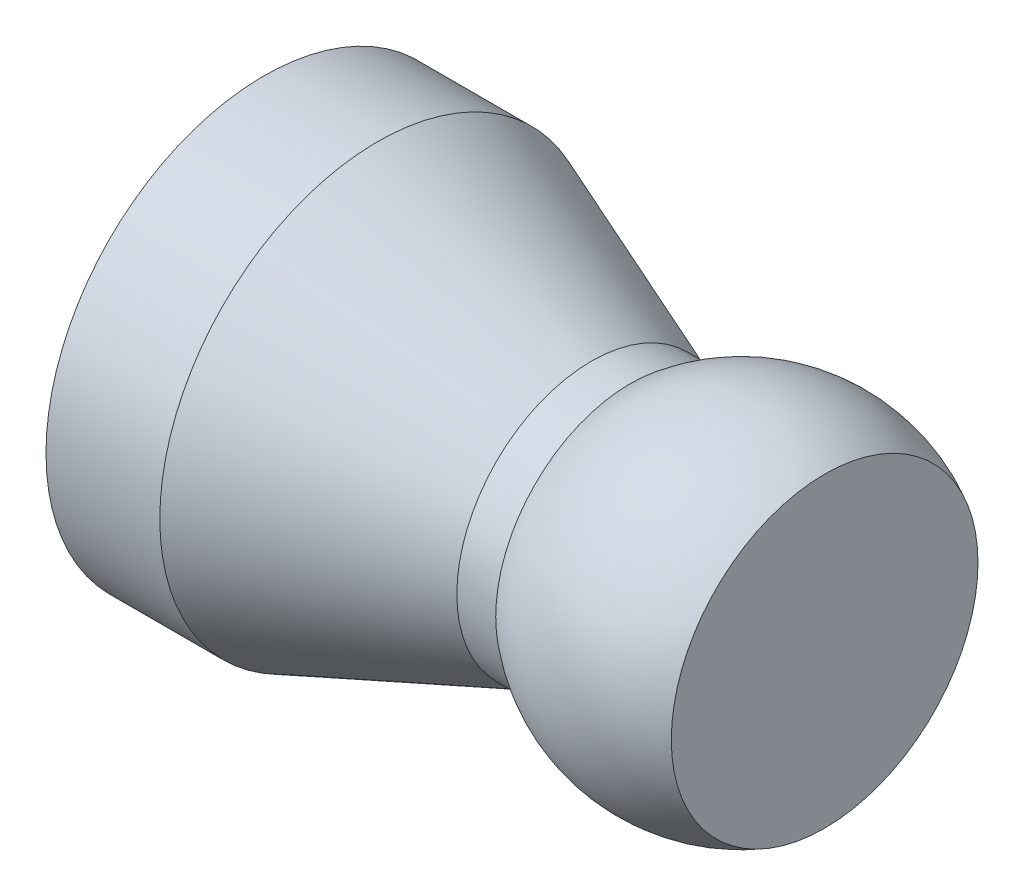
from build123d import *


with BuildPart() as part:
    # 草图1 → 旋转1 (revolve)
    with BuildSketch(Plane.XY):
        with BuildLine():
            Line((0, 0), (0, 7.85))
            Line((0, 7.85), (4.1, 7.85))
            Line((4.1, 7.85), (11.8, 4.85))
            Line((11.8, 4.85), (13.20030223, 4.85))
            ThreePointArc((13.20030223, 4.85), (16.597019137, 6.257515188), (20.2, 5.524498371))
            Line((20.2, 5.524498371), (20.2, 0))
            Line((20.2, 0), (0, 0))
        make_face()
    revolve(axis=Axis((20.2, 0, 0), (-1, 0, 0)))

    # 草图2 → 切除-旋转1 (revolve, cut)
    with BuildSketch(Plane.XY):
        with BuildLine():
            Line((8.9865, 0), (-3.5865, 0))
            ThreePointArc((-3.5865, 0), (2.7, 6.2865), (8.9865, 0))
        make_face()
    revolve(axis=Axis((50, 0, 0), (-1, 0, 0)), mode=Mode.SUBTRACT)


solid = part.part
